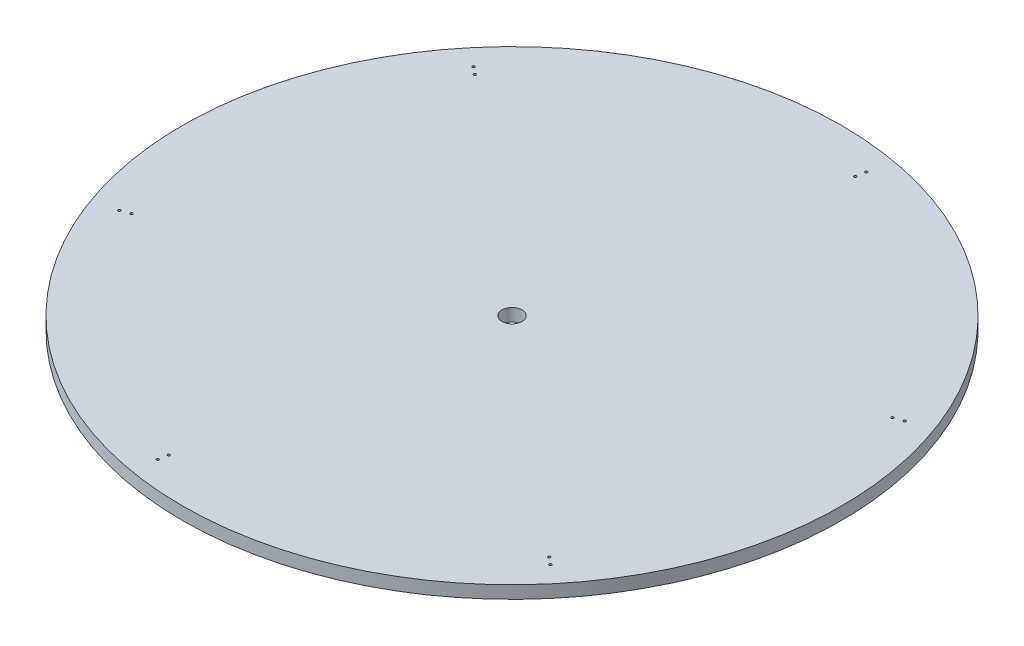
from build123d import *

# Parameters (mm, degrees)
SKETCH1_R           = 520
BOSS_EXTRUDE2_DEPTH = 20
CUT_EXTRUDE2_START  = -80
SKETCH5_R           = 15.875
SKETCH5_R_2         = 2.007091202
SKETCH5_R_3         = 2
CUT_EXTRUDE2_DEPTH  = 151
CIRPATTERN6_COUNT   = 6


with BuildPart() as part:
    # Sketch1 → Boss-Extrude2 (new body)
    with BuildSketch(Plane(origin=(0, 0, 0), x_dir=(1, 0, 0), z_dir=(0, 1, 0))):
        with Locations(Location((0, 0, 0), (0, 0, 270))):
            Circle(SKETCH1_R)
    extrude(amount=BOSS_EXTRUDE2_DEPTH)

    # Sketch5 → Cut-Extrude2 (cut)
    with BuildSketch(Plane(origin=(0, 20, 0), x_dir=(1, 0, 0), z_dir=(0, 1, 0)).offset(CUT_EXTRUDE2_START)):
        with Locations(Location((0, 0, 0), (0, 0, 270))):
            Circle(SKETCH5_R)
        with Locations(Location((-439.5310312, -160.737278228, 0), (0, 0, 270))):
            Circle(SKETCH5_R_2)
        with Locations(Location((-453.620726539, -165.883197509, 0), (0, 0, 270))):
            Circle(SKETCH5_R_3)
    cut_extrude2 = extrude(amount=CUT_EXTRUDE2_DEPTH, mode=Mode.SUBTRACT)

    # CirPattern6: Cut-Extrude2 ×6 about axis
    cirpattern6_axis = Axis((0, 0, 0), (0, 1, 0))
    for i in range(1, CIRPATTERN6_COUNT):
        add(cut_extrude2.rotate(cirpattern6_axis, i * 360 / CIRPATTERN6_COUNT), mode=Mode.SUBTRACT)


solid = part.part
